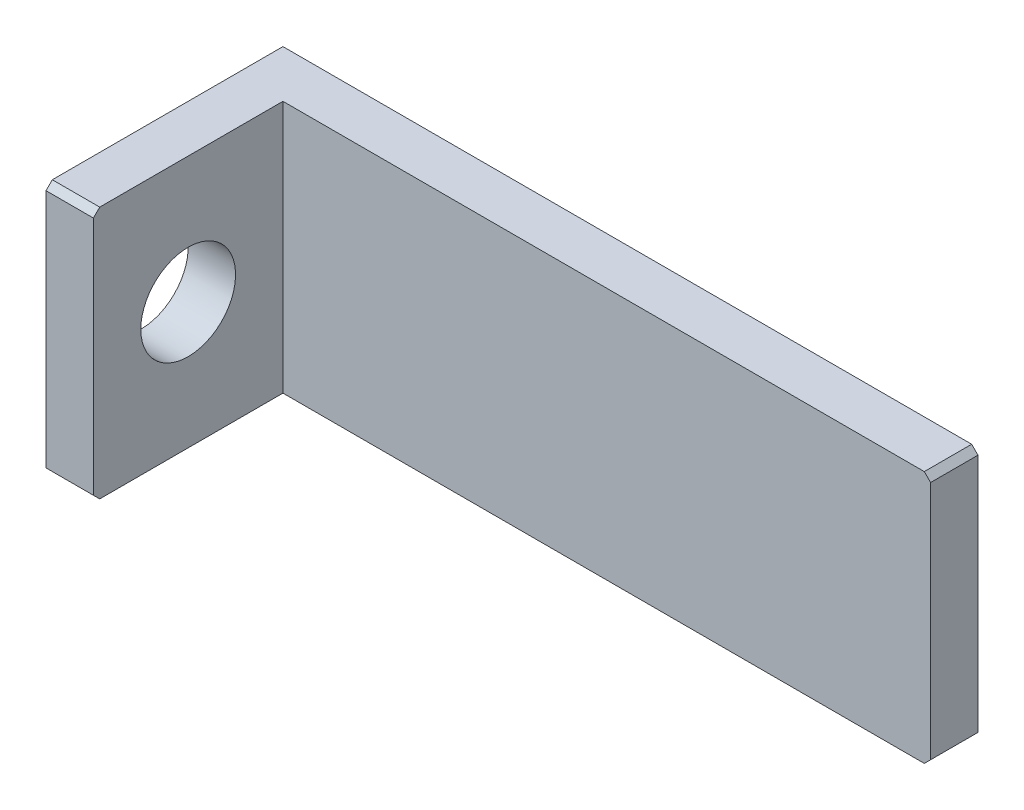
from build123d import *

# Parameters (mm, degrees)
SKETCH1_W                    = 22
SKETCH1_H                    = 8
BOSS_EXTRUDE1_DEPTH          = 7.5
SKETCH2_W                    = 20.5
SKETCH2_H                    = 6
CUT_EXTRUDE1_DEPTH           = 407.93506742
F_3_0_3_DIAMETER_HOLE1_D     = 3
F_3_0_3_DIAMETER_HOLE1_DEPTH = 22
CHAMFER1_SIZE                = 0.2


with BuildPart() as part:
    # Sketch1 → Boss-Extrude1 (new body)
    with BuildSketch(Plane.XY.offset(-366.357743681)):
        with Locations((-149.507123162, 667.332012286)):
            Rectangle(SKETCH1_W, SKETCH1_H)
    extrude(amount=-BOSS_EXTRUDE1_DEPTH)

    # Sketch2 → Cut-Extrude1 (cut, through all)
    with BuildSketch(Plane.XZ.offset(-663.332012286)):
        with Locations((-148.757123162, -369.357743681)):
            Rectangle(SKETCH2_W, SKETCH2_H)
    extrude(amount=-CUT_EXTRUDE1_DEPTH, mode=Mode.SUBTRACT)

    # Ø3.0 (3) Diameter Hole1
    with Locations(Plane.ZY.offset(160.507123162)):
        with Locations((-369.357743681, 667.332012286)):
            Hole(F_3_0_3_DIAMETER_HOLE1_D / 2, depth=F_3_0_3_DIAMETER_HOLE1_DEPTH)

    # Chamfer1
    chamfer1_edges = [part.edges().sort_by_distance(p)[0] for p in [
        (-159.757123162, 671.332012286, -366.357743681),
        (-159.757123162, 663.332012286, -366.357743681),
        (-138.507123162, 671.332012286, -373.107743681),
        (-138.507123162, 663.332012286, -373.107743681),
    ]]
    chamfer(chamfer1_edges, length=CHAMFER1_SIZE)


solid = part.part
